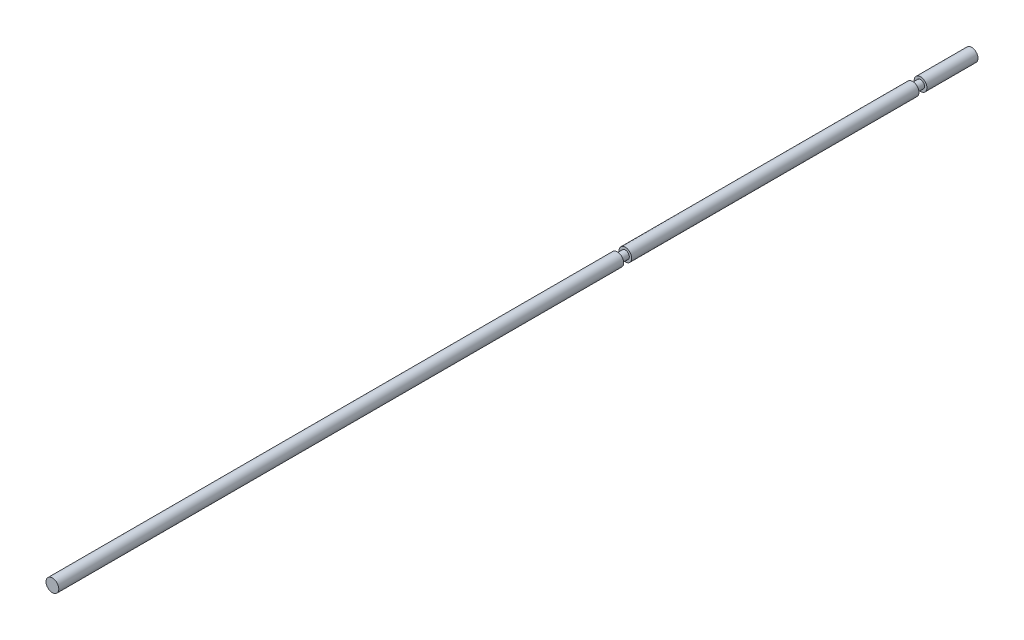
from build123d import *

# Parameters (mm, degrees)
SKETCH1_R           = 6.35
BOSS_EXTRUDE1_DEPTH = 914.4
SKETCH3_R           = 6.35
SKETCH3_R_2         = 3.96875
CUT_EXTRUDE1_DEPTH  = 7.9375
SKETCH4_R           = 6.35
SKETCH4_R_2         = 3.96875
CUT_EXTRUDE2_DEPTH  = 7.9375


with BuildPart() as part:
    # Sketch1 → Boss-Extrude1 (new body)
    with BuildSketch(Plane.XY):
        Circle(SKETCH1_R)
    extrude(amount=BOSS_EXTRUDE1_DEPTH)

    # Sketch3 → Cut-Extrude1 (cut)
    with BuildSketch(Plane(origin=(0, 0, 50.8), x_dir=(-1, 0, 0), z_dir=(0, 0, -1))):
        Circle(SKETCH3_R)
        Circle(SKETCH3_R_2, mode=Mode.SUBTRACT)
    extrude(amount=-CUT_EXTRUDE1_DEPTH, mode=Mode.SUBTRACT)

    # Sketch4 → Cut-Extrude2 (cut)
    with BuildSketch(Plane(origin=(0, 0, 344.4875), x_dir=(-1, 0, 0), z_dir=(0, 0, -1))):
        Circle(SKETCH4_R)
        Circle(SKETCH4_R_2, mode=Mode.SUBTRACT)
    extrude(amount=-CUT_EXTRUDE2_DEPTH, mode=Mode.SUBTRACT)


solid = part.part
